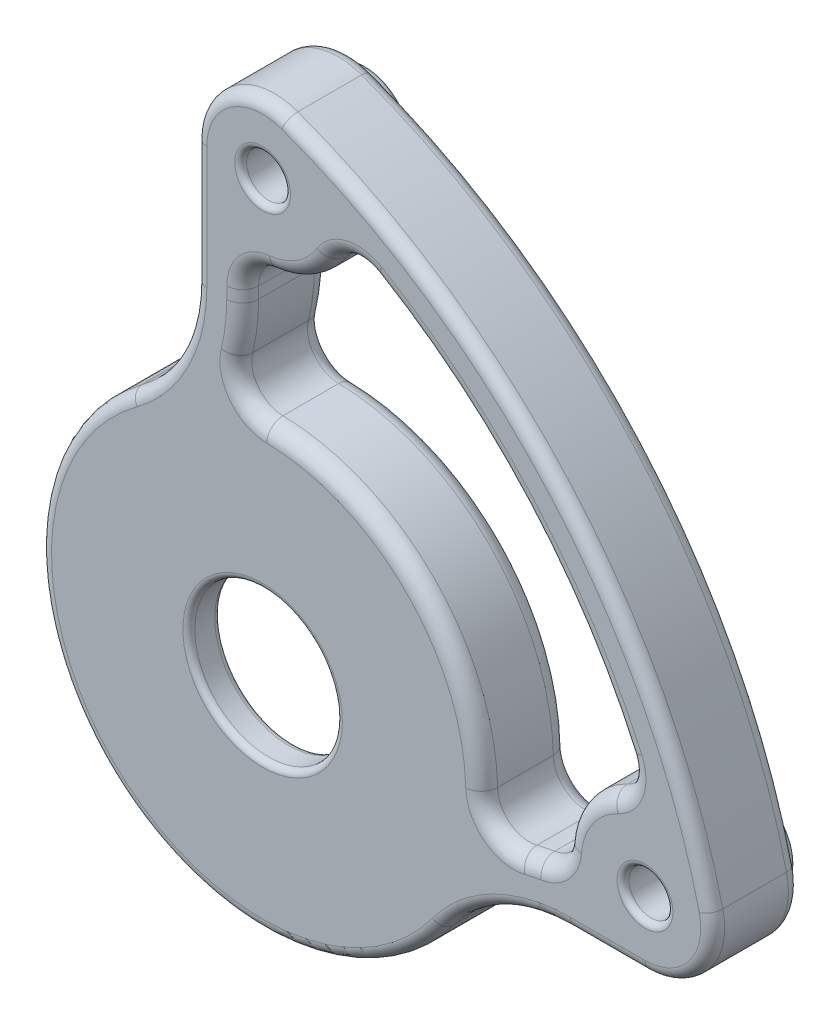
from build123d import *

# Parameters (mm, degrees)
SKETCH1_R           = 4.63
SKETCH1_R_2         = 1.375
BOSS_EXTRUDE1_DEPTH = 5.5
SKETCH2_R           = 3
SKETCH2_R_2         = 1.375
BOSS_EXTRUDE2_DEPTH = 1
CUT_EXTRUDE1_START  = -3.5
SKETCH3_R           = 4.63
CUT_EXTRUDE1_DEPTH  = 3.5
CUT_EXTRUDE2_DEPTH  = 43.48382045
FILLET1_R           = 2
FILLET2_R           = 1
FILLET3_R           = 0.75
CHAMFER1_SIZE       = 0.5
FILLET4_R           = 0.375
FILLET5_R           = 0.3125


with BuildPart() as part:
    # Sketch1 → Boss-Extrude1 (new body)
    with BuildSketch(Plane.XY):
        with BuildLine():
            Line((-4.25, 27), (-4.25, 19.311589784))
            ThreePointArc((-4.25, 19.311589784), (-5.323214464, 14.80465069), (-8.3125, 11.265094041))
            ThreePointArc((-8.3125, 11.265094041), (-9.899494937, -9.899494937), (11.265094041, -8.3125))
            ThreePointArc((11.265094041, -8.3125), (14.80465069, -5.323214464), (19.311589784, -4.25))
            Line((19.311589784, -4.25), (24, -4.25))
            ThreePointArc((24, -4.25), (27.336565295, -2.632457413), (28.133348727, 0.988902572))
            ThreePointArc((28.133348727, 0.988902572), (18.564757498, 19.335339998), (1.466682061, 30.988902572))
            ThreePointArc((1.466682061, 30.988902572), (-2.431984914, 30.48539085), (-4.25, 27))
        make_face()
        Circle(SKETCH1_R, mode=Mode.SUBTRACT)
        with Locations((0, 27)):
            Circle(SKETCH1_R_2, mode=Mode.SUBTRACT)
        with Locations((24, 0)):
            Circle(SKETCH1_R_2, mode=Mode.SUBTRACT)
    extrude(amount=BOSS_EXTRUDE1_DEPTH)

    # Sketch2 → Boss-Extrude2 (add)
    # profile 1 of 2: a face of its own
    with BuildSketch(Plane.XY.offset(5.5)):
        with Locations((0, 27)):
            Circle(SKETCH2_R)
        with Locations((0, 27)):
            Circle(SKETCH2_R_2, mode=Mode.SUBTRACT)
    # profile 2 of 2: a face of its own
    with BuildSketch(Plane.XY.offset(5.5)):
        with Locations((24, 0)):
            Circle(SKETCH2_R)
        with Locations((24, 0)):
            Circle(SKETCH2_R_2, mode=Mode.SUBTRACT)
    extrude(amount=BOSS_EXTRUDE2_DEPTH)

    # Sketch3 → Cut-Extrude1 (cut)
    with BuildSketch(Plane.XY.offset(5.5).offset(CUT_EXTRUDE1_START)):
        with BuildLine():
            ThreePointArc((11.75, 0), (6.610075543, 9.714391453), (-4.312876819, 10.929848743))
            ThreePointArc((-4.312876819, 10.929848743), (-8.308504679, -8.308504679), (10.929848743, -4.312876819))
            ThreePointArc((10.929848743, -4.312876819), (11.543141313, -2.195082831), (11.75, 0))
        make_face()
        Circle(SKETCH3_R, mode=Mode.SUBTRACT)
    extrude(amount=CUT_EXTRUDE1_DEPTH, mode=Mode.SUBTRACT)

    # Sketch3<3> → Cut-Extrude2 (cut, through all)
    with BuildSketch(Plane.XY.offset(5.5)):
        with BuildLine():
            Line((-1.25, 22.158770817), (-1.25, 19.311589784))
            ThreePointArc((-1.25, 19.311589784), (-1.597793083, 16.324674965), (-2.622563098, 13.497579887))
            ThreePointArc((-2.622563098, 13.497579887), (9.722718241, 9.722718241), (13.497579887, -2.622563098))
            ThreePointArc((13.497579887, -2.622563098), (16.250472413, -1.615540754), (19.159002131, -1.250895531))
            ThreePointArc((19.159002131, -1.250895531), (19.979035121, 2.971841422), (23.77521928, 4.994944807))
            ThreePointArc((23.77521928, 4.994944807), (16.322529542, 17.342248481), (4.93414331, 26.191155273))
            ThreePointArc((4.93414331, 26.191155273), (2.730981341, 22.811713845), (-1.25, 22.158770817))
        make_face()
    extrude(amount=-CUT_EXTRUDE2_DEPTH, mode=Mode.SUBTRACT)

    # Fillet1
    fillet1_edges = [part.edges().sort_by_distance(p)[0] for p in [
        (23.77521928, 4.994944807, 2.75),
        (4.93414331, 26.191155273, 2.75),
        (-1.25, 22.158770817, 2.75),
        (-2.622563098, 13.497579887, 2.75),
        (19.159002131, -1.250895531, 2.75),
        (13.497579887, -2.622563098, 2.75),
    ]]
    fillet(fillet1_edges, radius=FILLET1_R)

    # Fillet2
    fillet2_edges = [part.edges().sort_by_distance(p)[0] for p in [
        (-0.738047618, 21.376600756, 0),
        (-1.265545865, 14.528021203, 0),
        (9.722718241, 9.722718241, 0),
        (19.900638802, 2.86273257, 0),
        (22.930555235, 5.648940441, 0),
        (16.322529542, 17.342248481, 0),
        (5.484599052, 25.275641147, 0),
        (-0.738047618, 21.376600756, 5.5),
        (-1.265545865, 14.528021203, 5.5),
        (9.722718241, 9.722718241, 5.5),
        (19.900638802, 2.86273257, 5.5),
        (22.930555235, 5.648940441, 5.5),
        (16.322529542, 17.342248481, 5.5),
        (5.484599052, 25.275641147, 5.5),
        (2.670516536, 22.772903901, 0),
        (2.670516536, 22.772903901, 5.5),
        (-1.343450694, 17.755638299, 0),
        (-1.343450694, 17.755638299, 5.5),
        (-1.25, 19.675942165, 0),
        (-1.25, 19.675942165, 5.5),
        (14.528021203, -1.265545865, 0),
        (16.772975007, -1.500277061, 0),
        (18.487108352, -0.788672851, 0),
        (14.528021203, -1.265545865, 5.5),
        (16.772975007, -1.500277061, 5.5),
        (18.487108352, -0.788672851, 5.5),
    ]]
    fillet(fillet2_edges, radius=FILLET2_R)

    # Fillet3
    fillet3_edges = [part.edges().sort_by_distance(p)[0] for p in [
        (27.336565295, -2.632457413, 0),
        (21.655794892, -4.25, 0),
        (14.80465069, -5.323214464, 0),
        (-9.899494937, -9.899494937, 0),
        (-5.323214464, 14.80465069, 0),
        (-4.25, 23.155794892, 0),
        (-2.431984914, 30.48539085, 0),
        (27.336565295, -2.632457413, 5.5),
        (21.655794892, -4.25, 5.5),
        (14.80465069, -5.323214464, 5.5),
        (-9.899494937, -9.899494937, 5.5),
        (-5.323214464, 14.80465069, 5.5),
        (-4.25, 23.155794892, 5.5),
        (-2.431984914, 30.48539085, 5.5),
        (18.564757498, 19.335339998, 0),
        (18.564757498, 19.335339998, 5.5),
    ]]
    fillet(fillet3_edges, radius=FILLET3_R)

    # Chamfer1
    chamfer1_edges = [part.edges().sort_by_distance(p)[0] for p in [
        (22.625, 0, 6.5),
        (-1.375, 27, 6.5),
    ]]
    chamfer(chamfer1_edges, length=CHAMFER1_SIZE)

    # Fillet4
    fillet4_edges = [part.edges().sort_by_distance(p)[0] for p in [
        (-4.63, 0, 0),
        (-1.375, 27, 0),
        (22.625, 0, 0),
        (21, 0, 6.5),
        (21, 0, 5.5),
        (-3, 27, 5.5),
        (-3, 27, 6.5),
        (-4.63, 0, 2),
        (22.625, 0, 6),
        (22.125, 0, 6.5),
        (-1.375, 27, 6),
        (-1.875, 27, 6.5),
    ]]
    fillet(fillet4_edges, radius=FILLET4_R)

    # Fillet5
    fillet5_edges = [part.edges().sort_by_distance(p)[0] for p in [
        (-10.929848743, 4.312876819, 5.5),
        (-10.929848743, 4.312876819, 2),
    ]]
    fillet(fillet5_edges, radius=FILLET5_R)


with BuildPart() as body_2:
    # Mirror1: mirrored copy
    add(part.part.mirror(Plane(origin=(19.311589784, -14.25, 0), x_dir=(1, 0, 0), z_dir=(0, 0, 1))))


solid = body_2.part
